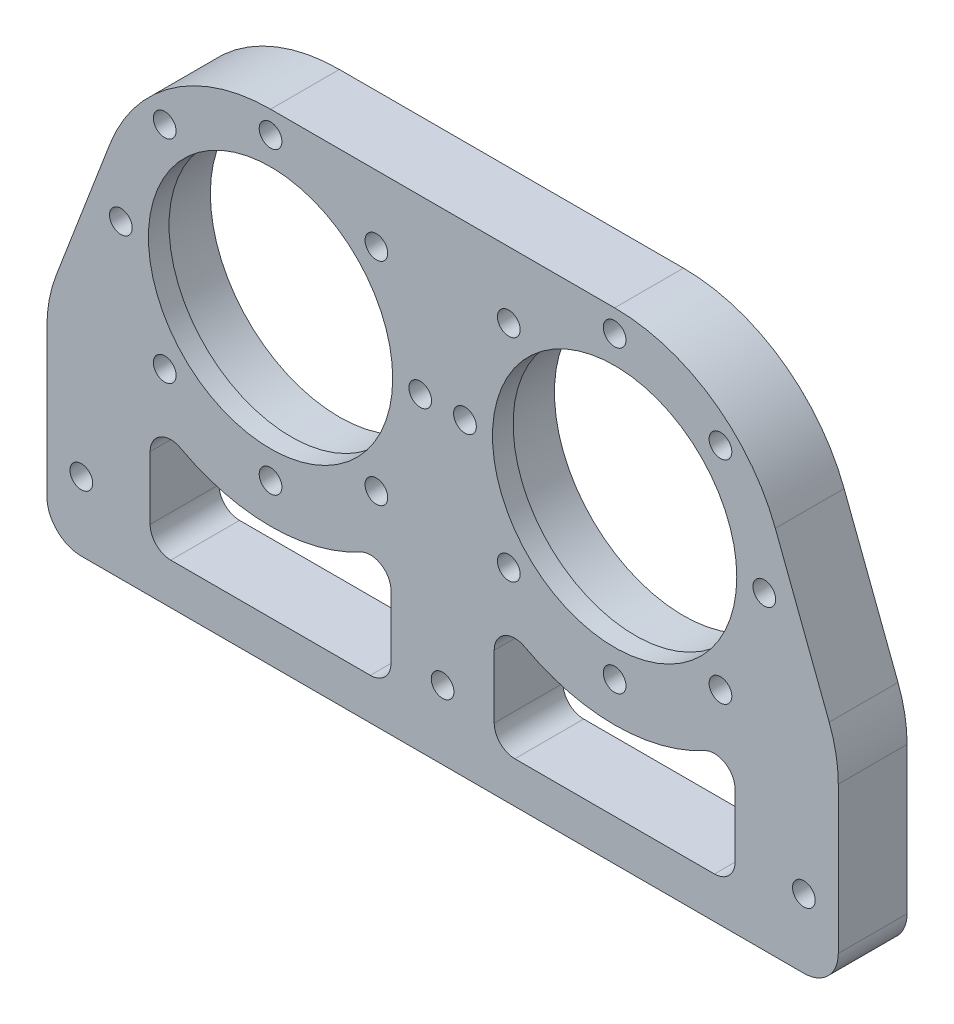
from build123d import *

# Parameters (mm, degrees)
EXTRUDE_1_DEPTH     = 10
FILLET_1_R          = 20
SKETCH_2_R          = 18.75
CUT_EXTRUDE_1_DEPTH = 81.195074662
SKETCH_5_R          = 1.65
CUT_EXTRUDE_4_DEPTH = 81.195074662
SKETCH_6_R          = 1.65
CUT_EXTRUDE_5_DEPTH = 81.195074662
SKETCH_7_R          = 18.75
SKETCH_7_R_2        = 17.75
EXTRUDE_2_DEPTH     = 3
CUT_EXTRUDE_6_DEPTH = 10
FILLET_5_R          = 5
FILLET_6_R          = 3


with BuildPart() as part:
    # ｽｹｯﾁ1 → ﾎﾞｽ - 押し出し1 (new body)
    with BuildSketch(Plane.XY):
        with BuildLine():
            Line((57.5, -15), (57.5, 15))
            Line((57.5, 15), (48.35142739, 38.928092678))
            ThreePointArc((48.35142739, 38.928092678), (39.173878846, 50.59371648), (25, 55))
            Line((25, 55), (-25, 55))
            ThreePointArc((-25, 55), (-39.173878846, 50.59371648), (-48.35142739, 38.928092678))
            Line((-48.35142739, 38.928092678), (-57.5, 15))
            Line((-57.5, 15), (-57.5, -15))
            Line((-57.5, -15), (57.5, -15))
        make_face()
    extrude(amount=EXTRUDE_1_DEPTH)

    # ﾌｨﾚｯﾄ1
    fillet_1_edges = [part.edges().sort_by_distance(p)[0] for p in [
        (57.5, 15, 5),
        (-57.5, 15, 5),
    ]]
    fillet(fillet_1_edges, radius=FILLET_1_R)

    # ｽｹｯﾁ2 → ｶｯﾄ - 押し出し1 (cut, through all)
    with BuildSketch(Plane.XY.offset(10)):
        with Locations((25, 30)):
            Circle(SKETCH_2_R)
        with Locations(Location((-25, 30, 0), (0, 0, 180))):
            Circle(SKETCH_2_R)
    extrude(amount=-CUT_EXTRUDE_1_DEPTH, mode=Mode.SUBTRACT)

    # ｽｹｯﾁ5 → ｶｯﾄ - 押し出し4 (cut, through all)
    with BuildSketch(Plane(origin=(0, 0, 0), x_dir=(-1, 0, 0), z_dir=(0, 0, -1))):
        with Locations((-25, 51.75)):
            Circle(SKETCH_5_R)
        with Locations((-9.620427509, 45.379572491)):
            Circle(SKETCH_5_R)
        with Locations((-3.25, 30)):
            Circle(SKETCH_5_R)
        with Locations((-9.620427509, 14.620427509)):
            Circle(SKETCH_5_R)
        with Locations((-25, 8.25)):
            Circle(SKETCH_5_R)
        with Locations((-40.379572491, 14.620427509)):
            Circle(SKETCH_5_R)
        with Locations((-46.75, 30)):
            Circle(SKETCH_5_R)
        with Locations((-40.379572491, 45.379572491)):
            Circle(SKETCH_5_R)
        with Locations(Location((40.379572491, 45.379572491, 0), (0, 0, 180))):
            Circle(SKETCH_5_R)
        with Locations(Location((46.75, 30, 0), (0, 0, 180))):
            Circle(SKETCH_5_R)
        with Locations(Location((40.379572491, 14.620427509, 0), (0, 0, 180))):
            Circle(SKETCH_5_R)
        with Locations(Location((25, 8.25, 0), (0, 0, 180))):
            Circle(SKETCH_5_R)
        with Locations(Location((9.620427509, 14.620427509, 0), (0, 0, 180))):
            Circle(SKETCH_5_R)
        with Locations(Location((3.25, 30, 0), (0, 0, 180))):
            Circle(SKETCH_5_R)
        with Locations(Location((9.620427509, 45.379572491, 0), (0, 0, 180))):
            Circle(SKETCH_5_R)
        with Locations(Location((25, 51.75, 0), (0, 0, 180))):
            Circle(SKETCH_5_R)
    extrude(amount=-CUT_EXTRUDE_4_DEPTH, mode=Mode.SUBTRACT)

    # ｽｹｯﾁ6 → ｶｯﾄ - 押し出し5 (cut, through all)
    with BuildSketch(Plane(origin=(0, 0, 0), x_dir=(-1, 0, 0), z_dir=(0, 0, -1))):
        with Locations((-52.5, -5)):
            Circle(SKETCH_6_R)
        with Locations(Location((52.5, -5, 0), (0, 0, 180))):
            Circle(SKETCH_6_R)
        with Locations((0, -5)):
            Circle(SKETCH_6_R)
    extrude(amount=-CUT_EXTRUDE_5_DEPTH, mode=Mode.SUBTRACT)

    # ｽｹｯﾁ7 → ﾎﾞｽ - 押し出し2 (add)
    # profile 1 of 2: a face of its own
    with BuildSketch(Plane.XY.offset(10)):
        with Locations((-25, 30)):
            Circle(SKETCH_7_R)
        with Locations((-25, 30)):
            Circle(SKETCH_7_R_2, mode=Mode.SUBTRACT)
    # profile 2 of 2: a face of its own
    with BuildSketch(Plane.XY.offset(10)):
        with Locations((25, 30)):
            Circle(SKETCH_7_R)
        with Locations((25, 30)):
            Circle(SKETCH_7_R_2, mode=Mode.SUBTRACT)
    extrude(amount=-EXTRUDE_2_DEPTH)

    # ｽｹｯﾁ8 → ｶｯﾄ - 押し出し6 (cut)
    with BuildSketch(Plane(origin=(0, 0, 0), x_dir=(-1, 0, 0), z_dir=(0, 0, -1))):
        with BuildLine():
            Line((-42.5, -9), (-7.5, -9))
            Line((-7.5, -9), (-7.5, 8.786796564))
            ThreePointArc((-7.5, 8.786796564), (-25, 2.5), (-42.5, 8.786796564))
            Line((-42.5, 8.786796564), (-42.5, -9))
        make_face()
        with BuildLine():
            Line((42.5, -9), (42.5, 8.786796564))
            ThreePointArc((42.5, 8.786796564), (25, 2.5), (7.5, 8.786796564))
            Line((7.5, 8.786796564), (7.5, -9))
            Line((7.5, -9), (42.5, -9))
        make_face()
    extrude(amount=-CUT_EXTRUDE_6_DEPTH, mode=Mode.SUBTRACT)

    # ﾌｨﾚｯﾄ5
    fillet_5_edges = [part.edges().sort_by_distance(p)[0] for p in [
        (57.5, -15, 5),
        (-57.5, -15, 5),
    ]]
    fillet(fillet_5_edges, radius=FILLET_5_R)

    # ﾌｨﾚｯﾄ6
    fillet_6_edges = [part.edges().sort_by_distance(p)[0] for p in [
        (7.5, -9, 5),
        (7.5, 8.786796564, 5),
        (42.5, 8.786796564, 5),
        (42.5, -9, 5),
        (-42.5, 8.786796564, 5),
        (-7.5, 8.786796564, 5),
        (-7.5, -9, 5),
        (-42.5, -9, 5),
    ]]
    fillet(fillet_6_edges, radius=FILLET_6_R)


solid = part.part
